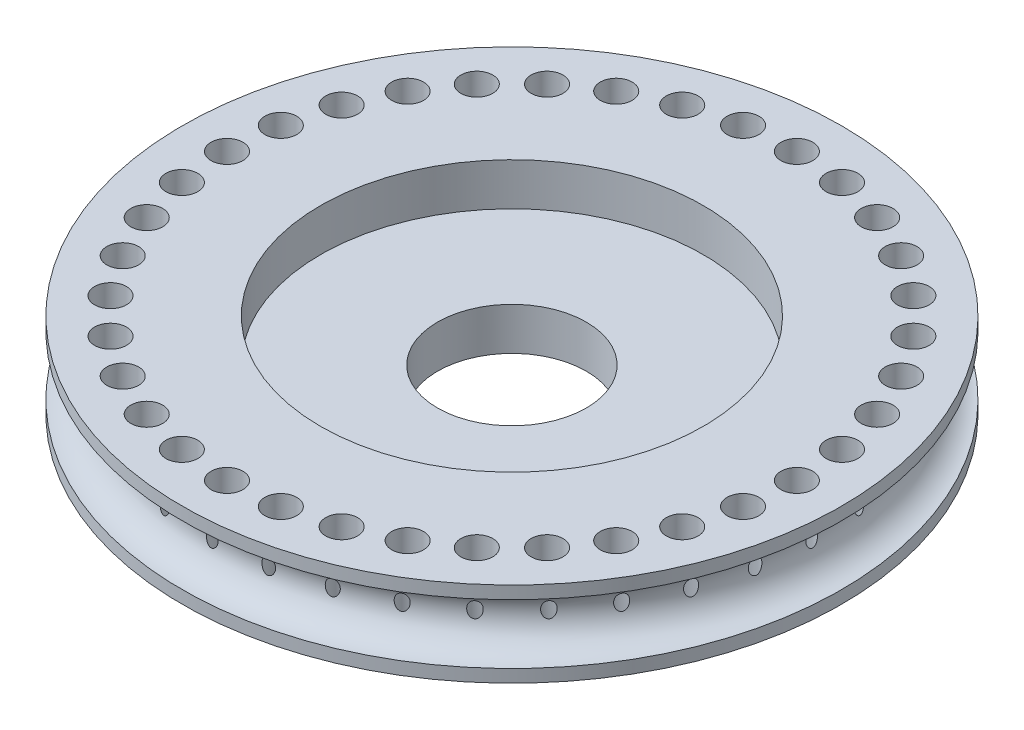
from build123d import *

# Parameters (mm, degrees)
SKETCH2_R          = 9
CUT_EXTRUDE1_DEPTH = 2
SKETCH3_R          = 0.75
CUT_EXTRUDE2_DEPTH = 23.282279955


with BuildPart() as part:
    # Sketch1 → Revolve1 (revolve)
    with BuildSketch(Plane.XY, mode=Mode.PRIVATE) as revolve1_sk:
        with BuildLine():
            Line((-15.5, 0), (-3.5, 0))
            Line((-3.5, 0), (-3.5, 4))
            Line((-3.5, 4), (-15.5, 4))
            Line((-15.5, 4), (-15.5, 3.4))
            ThreePointArc((-15.5, 3.4), (-14.510050506, 2.989949494), (-14.1, 2))
            ThreePointArc((-14.1, 2), (-14.510050506, 1.010050506), (-15.5, 0.6))
            Line((-15.5, 0.6), (-15.5, 0))
        make_face()
    revolve(revolve1_sk.sketch.rotate(Axis((0, 0, 0), (0, 1, 0)), 270), axis=Axis((0, 0, 0), (0, 1, 0)))

    # Sketch2 → Cut-Extrude1 (cut)
    with BuildSketch(Plane(origin=(0, 4, 0), x_dir=(1, 0, 0), z_dir=(0, 1, 0))):
        with Locations(Location((0, 0, 0), (0, 0, 270))):
            Circle(SKETCH2_R)
    extrude(amount=-CUT_EXTRUDE1_DEPTH, mode=Mode.SUBTRACT)

    # Sketch3 → Cut-Extrude2 (cut, through all)
    with BuildSketch(Plane(origin=(0, 4, 0), x_dir=(1, 0, 0), z_dir=(0, 1, 0))):
        with Locations(Location((0, 13.4, 0), (0, 0, 270))):
            Circle(SKETCH3_R)
        with Locations(Location((2.326885581, 13.19642389, 0), (0, 0, 270))):
            Circle(SKETCH3_R)
        with Locations(Location((4.583069921, 12.591881119, 0), (0, 0, 270))):
            Circle(SKETCH3_R)
        with Locations(Location((6.7, 11.604740411, 0), (0, 0, 270))):
            Circle(SKETCH3_R)
        with Locations(Location((8.61335397, 10.264995538, 0), (0, 0, 270))):
            Circle(SKETCH3_R)
        with Locations(Location((10.264995538, 8.61335397, 0), (0, 0, 270))):
            Circle(SKETCH3_R)
        with Locations(Location((11.604740411, 6.7, 0), (0, 0, 270))):
            Circle(SKETCH3_R)
        with Locations(Location((12.591881119, 4.583069921, 0), (0, 0, 270))):
            Circle(SKETCH3_R)
        with Locations(Location((13.19642389, 2.326885581, 0), (0, 0, 270))):
            Circle(SKETCH3_R)
        with Locations(Location((13.4, 0, 0), (0, 0, 270))):
            Circle(SKETCH3_R)
        with Locations(Location((13.19642389, -2.326885581, 0), (0, 0, 270))):
            Circle(SKETCH3_R)
        with Locations(Location((12.591881119, -4.583069921, 0), (0, 0, 270))):
            Circle(SKETCH3_R)
        with Locations(Location((11.604740411, -6.7, 0), (0, 0, 270))):
            Circle(SKETCH3_R)
        with Locations(Location((10.264995538, -8.61335397, 0), (0, 0, 270))):
            Circle(SKETCH3_R)
        with Locations(Location((8.61335397, -10.264995538, 0), (0, 0, 270))):
            Circle(SKETCH3_R)
        with Locations(Location((6.7, -11.604740411, 0), (0, 0, 270))):
            Circle(SKETCH3_R)
        with Locations(Location((4.583069921, -12.591881119, 0), (0, 0, 270))):
            Circle(SKETCH3_R)
        with Locations(Location((2.326885581, -13.19642389, 0), (0, 0, 270))):
            Circle(SKETCH3_R)
        with Locations(Location((0, -13.4, 0), (0, 0, 270))):
            Circle(SKETCH3_R)
        with Locations(Location((-2.326885581, -13.19642389, 0), (0, 0, 270))):
            Circle(SKETCH3_R)
        with Locations(Location((-4.583069921, -12.591881119, 0), (0, 0, 270))):
            Circle(SKETCH3_R)
        with Locations(Location((-6.7, -11.604740411, 0), (0, 0, 270))):
            Circle(SKETCH3_R)
        with Locations(Location((-8.61335397, -10.264995538, 0), (0, 0, 270))):
            Circle(SKETCH3_R)
        with Locations(Location((-10.264995538, -8.61335397, 0), (0, 0, 270))):
            Circle(SKETCH3_R)
        with Locations(Location((-11.604740411, -6.7, 0), (0, 0, 270))):
            Circle(SKETCH3_R)
        with Locations(Location((-12.591881119, -4.583069921, 0), (0, 0, 270))):
            Circle(SKETCH3_R)
        with Locations(Location((-13.19642389, -2.326885581, 0), (0, 0, 270))):
            Circle(SKETCH3_R)
        with Locations(Location((-13.4, 0, 0), (0, 0, 270))):
            Circle(SKETCH3_R)
        with Locations(Location((-13.19642389, 2.326885581, 0), (0, 0, 270))):
            Circle(SKETCH3_R)
        with Locations(Location((-12.591881119, 4.583069921, 0), (0, 0, 270))):
            Circle(SKETCH3_R)
        with Locations(Location((-11.604740411, 6.7, 0), (0, 0, 270))):
            Circle(SKETCH3_R)
        with Locations(Location((-10.264995538, 8.61335397, 0), (0, 0, 270))):
            Circle(SKETCH3_R)
        with Locations(Location((-8.61335397, 10.264995538, 0), (0, 0, 270))):
            Circle(SKETCH3_R)
        with Locations(Location((-6.7, 11.604740411, 0), (0, 0, 270))):
            Circle(SKETCH3_R)
        with Locations(Location((-4.583069921, 12.591881119, 0), (0, 0, 270))):
            Circle(SKETCH3_R)
        with Locations(Location((-2.326885581, 13.19642389, 0), (0, 0, 270))):
            Circle(SKETCH3_R)
    extrude(amount=-CUT_EXTRUDE2_DEPTH, mode=Mode.SUBTRACT)


solid = part.part
